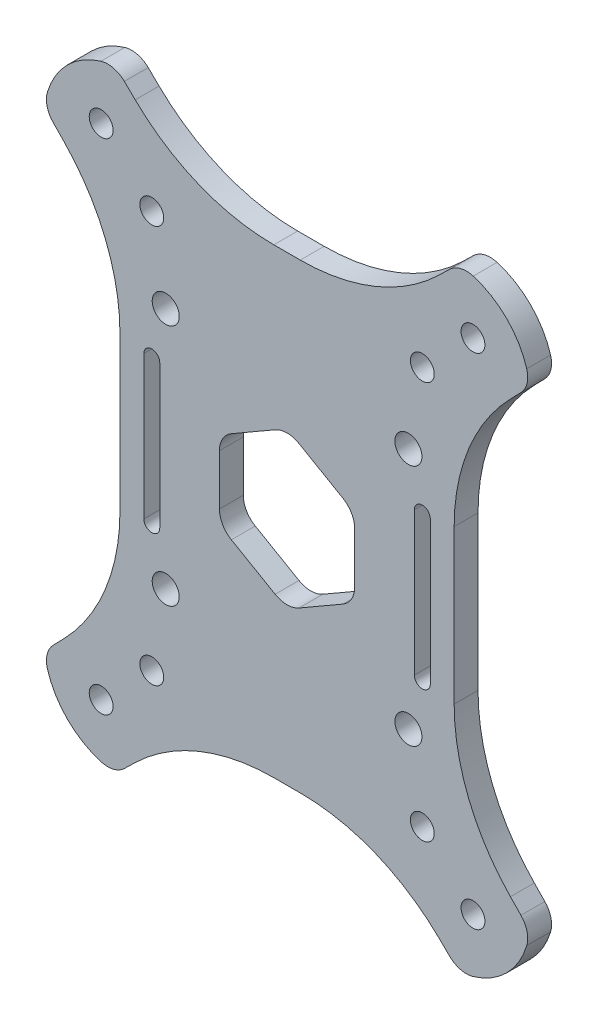
from build123d import *

# Parameters (mm, degrees)
AUFSATZ_LINEAR_AUSTRAGEN1_DEPTH = 3
VERRUNDUNG1_R                   = 25
VERRUNDUNG2_R                   = 3
SKIZZE3_R                       = 8.5
SCHNITT_LINEAR_AUSTRAGEN1_DEPTH = 49.848849018
SCHNITT_LINEAR_AUSTRAGEN4_DEPTH = 4
SKIZZE4_R                       = 1.5
SKIZZE4_R_2                     = 1.7
SCHNITT_LINEAR_AUSTRAGEN2_DEPTH = 49.848849018
SCHNITT_LINEAR_AUSTRAGEN3_DEPTH = 49.848849018


with BuildPart() as part:
    # Skizze2 → Aufsatz-Linear austragen1 (new body)
    with BuildSketch(Plane.XY):
        with BuildLine():
            Line((-21, -19.807611845), (-21, 19.807611845))
            Line((-21, 19.807611845), (-30.482365961, 29.565355279))
            ThreePointArc((-30.482365961, 29.565355279), (-27.606601718, 35.606601718), (-21.565355279, 38.482365961))
            Line((-21.565355279, 38.482365961), (-11.807611845, 29))
            Line((-11.807611845, 29), (11.807611845, 29))
            Line((11.807611845, 29), (21.565355279, 38.482365961))
            ThreePointArc((21.565355279, 38.482365961), (27.606601718, 35.606601718), (30.482365961, 29.565355279))
            Line((30.482365961, 29.565355279), (21, 19.807611845))
            Line((21, 19.807611845), (21, -19.807611845))
            Line((21, -19.807611845), (30.482365961, -29.565355279))
            ThreePointArc((30.482365961, -29.565355279), (27.606601718, -35.606601718), (21.565355279, -38.482365961))
            Line((21.565355279, -38.482365961), (11.807611845, -29))
            Line((11.807611845, -29), (-11.807611845, -29))
            Line((-11.807611845, -29), (-21.565355279, -38.482365961))
            ThreePointArc((-21.565355279, -38.482365961), (-27.606601718, -35.606601718), (-30.482365961, -29.565355279))
            Line((-30.482365961, -29.565355279), (-21, -19.807611845))
        make_face()
    extrude(amount=AUFSATZ_LINEAR_AUSTRAGEN1_DEPTH)

    # Verrundung1
    verrundung1_edges = [part.edges().sort_by_distance(p)[0] for p in [
        (-21, -19.807611845, 1.5),
        (-21, 19.807611845, 1.5),
        (-11.807611845, 29, 1.5),
        (11.807611845, 29, 1.5),
        (21, 19.807611845, 1.5),
        (21, -19.807611845, 1.5),
        (11.807611845, -29, 1.5),
        (-11.807611845, -29, 1.5),
    ]]
    fillet(verrundung1_edges, radius=VERRUNDUNG1_R)

    # Verrundung2
    verrundung2_edges = [part.edges().sort_by_distance(p)[0] for p in [
        (-30.482365961, 29.565355279, 1.5),
        (-21.565355279, 38.482365961, 1.5),
        (21.565355279, 38.482365961, 1.5),
        (30.482365961, 29.565355279, 1.5),
        (30.482365961, -29.565355279, 1.5),
        (21.565355279, -38.482365961, 1.5),
        (-21.565355279, -38.482365961, 1.5),
        (-30.482365961, -29.565355279, 1.5),
    ]]
    fillet(verrundung2_edges, radius=VERRUNDUNG2_R)

    # Skizze3 → Schnitt-Linear austragen1 (cut, through all)
    with BuildSketch(Plane(origin=(0, 0, 0), x_dir=(-1, 0, 0), z_dir=(0, 0, -1))):
        Circle(SKIZZE3_R)
    extrude(amount=-SCHNITT_LINEAR_AUSTRAGEN1_DEPTH, mode=Mode.SUBTRACT)

    # Skizze7 → Schnitt-Linear austragen4 (cut)
    with BuildSketch(Plane.XY.offset(3)):
        with BuildLine():
            Line((-1.5, 8.948929172), (-7, 5.773502692))
            ThreePointArc((-7, 5.773502692), (-8.098076211, 4.675426481), (-8.5, 3.175426481))
            Line((-8.5, 3.175426481), (-8.5, -3.175426481))
            ThreePointArc((-8.5, -3.175426481), (-8.098076211, -4.675426481), (-7, -5.773502692))
            Line((-7, -5.773502692), (-1.5, -8.948929172))
            ThreePointArc((-1.5, -8.948929172), (0, -9.350852961), (1.5, -8.948929172))
            Line((1.5, -8.948929172), (7, -5.773502692))
            ThreePointArc((7, -5.773502692), (8.098076211, -4.675426481), (8.5, -3.175426481))
            Line((8.5, -3.175426481), (8.5, 3.175426481))
            ThreePointArc((8.5, 3.175426481), (8.098076211, 4.675426481), (7, 5.773502692))
            Line((7, 5.773502692), (1.5, 8.948929172))
            ThreePointArc((1.5, 8.948929172), (0, 9.350852961), (-1.5, 8.948929172))
        make_face()
    extrude(amount=-SCHNITT_LINEAR_AUSTRAGEN4_DEPTH, mode=Mode.SUBTRACT)

    # Skizze4 → Schnitt-Linear austragen2 (cut, through all)
    with BuildSketch(Plane(origin=(0, 0, 0), x_dir=(-1, 0, 0), z_dir=(0, 0, -1))):
        with Locations((-23.363961031, 31.363961031)):
            Circle(SKIZZE4_R)
        with Locations((-17, 25)):
            Circle(SKIZZE4_R)
        with Locations((-15.25, 15.25)):
            Circle(SKIZZE4_R_2)
        with Locations((-17, -25)):
            Circle(SKIZZE4_R)
        with Locations((-15.25, -15.25)):
            Circle(SKIZZE4_R_2)
        with Locations((-23.363961031, -31.363961031)):
            Circle(SKIZZE4_R)
        with Locations((23.363961031, -31.363961031)):
            Circle(SKIZZE4_R)
        with Locations((17, -25)):
            Circle(SKIZZE4_R)
        with Locations((15.25, -15.25)):
            Circle(SKIZZE4_R_2)
        with Locations((23.363961031, 31.363961031)):
            Circle(SKIZZE4_R)
        with Locations((17, 25)):
            Circle(SKIZZE4_R)
        with Locations((15.25, 15.25)):
            Circle(SKIZZE4_R_2)
    extrude(amount=-SCHNITT_LINEAR_AUSTRAGEN2_DEPTH, mode=Mode.SUBTRACT)

    # Skizze5 → Schnitt-Linear austragen3 (cut, through all)
    with BuildSketch(Plane.XY.offset(3)):
        with BuildLine():
            Line((18, 9), (18, -9))
            ThreePointArc((18, -9), (17, -10), (16, -9))
            Line((16, -9), (16, 9))
            ThreePointArc((16, 9), (17, 10), (18, 9))
        make_face()
        with BuildLine():
            Line((-16, 9), (-16, -9))
            ThreePointArc((-16, -9), (-17, -10), (-18, -9))
            Line((-18, -9), (-18, 9))
            ThreePointArc((-18, 9), (-17, 10), (-16, 9))
        make_face()
    extrude(amount=-SCHNITT_LINEAR_AUSTRAGEN3_DEPTH, mode=Mode.SUBTRACT)


solid = part.part
